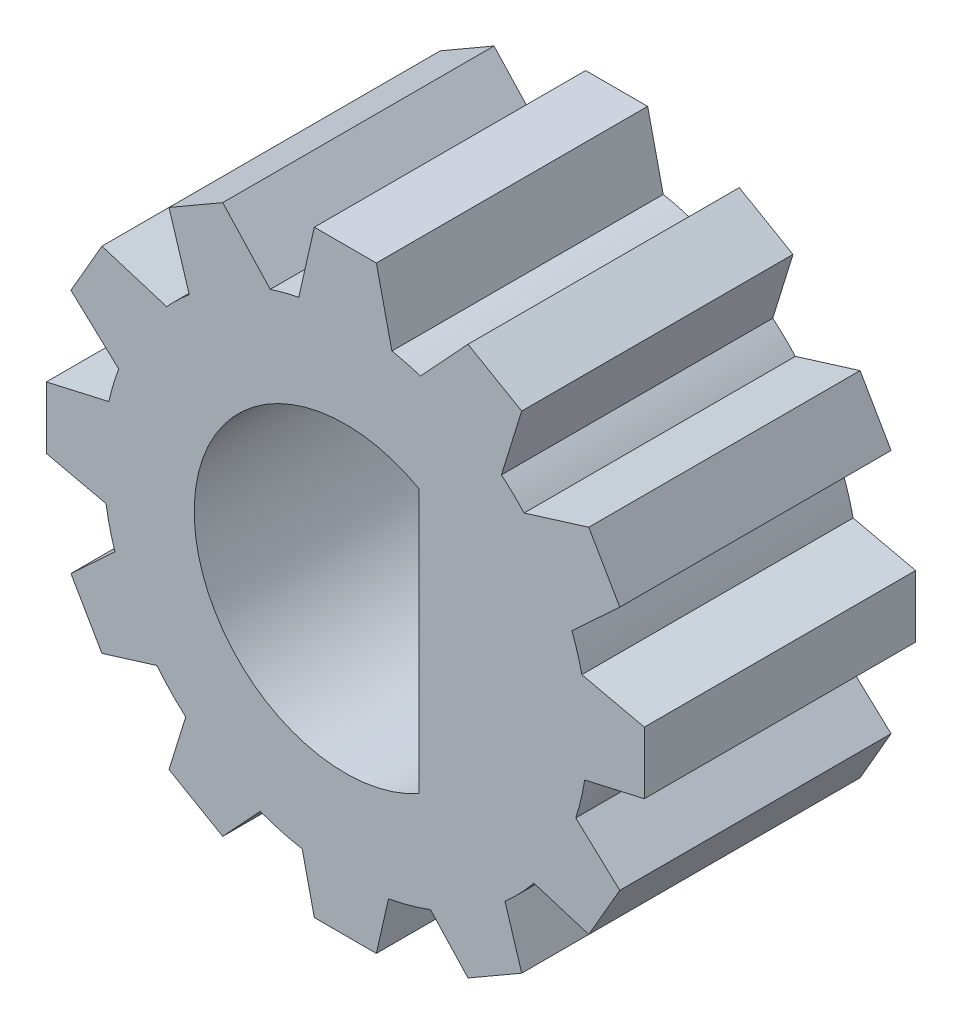
from build123d import *

# Parameters (mm, degrees)
SKETCH1_R           = 6.25
BOSS_EXTRUDE1_DEPTH = 7
BOSS_EXTRUDE2_DEPTH = 7
CIRPATTERN1_COUNT   = 12
CUT_EXTRUDE1_DEPTH  = 7


with BuildPart() as part:
    # Sketch1 → Boss-Extrude1 (new body)
    with BuildSketch(Plane.XY):
        with Locations(Location((0, 0, 0), (0, 0, 180))):
            Circle(SKETCH1_R)
    extrude(amount=BOSS_EXTRUDE1_DEPTH)

    # Sketch3 → Boss-Extrude2 (add)
    with BuildSketch(Plane.XY):
        Polygon((-0.8, 7.9), (0.8, 7.9), (1.3, 5.7), (-1.3, 5.7), align=None)
    boss_extrude2 = extrude(amount=BOSS_EXTRUDE2_DEPTH)

    # CirPattern1: Boss-Extrude2 ×12 about axis
    cirpattern1_axis = Axis((0, 0.185968122, 0), (0, 0, 1))
    for i in range(1, CIRPATTERN1_COUNT):
        add(boss_extrude2.rotate(cirpattern1_axis, i * 360 / CIRPATTERN1_COUNT))

    # Sketch4 → Cut-Extrude1 (cut)
    with BuildSketch(Plane.XY):
        with BuildLine():
            Line((1.9, 3.405877273), (1.9, -3.405877273))
            ThreePointArc((1.9, -3.405877273), (-3.9, 0), (1.9, 3.405877273))
        make_face()
    extrude(amount=CUT_EXTRUDE1_DEPTH, mode=Mode.SUBTRACT)


solid = part.part
